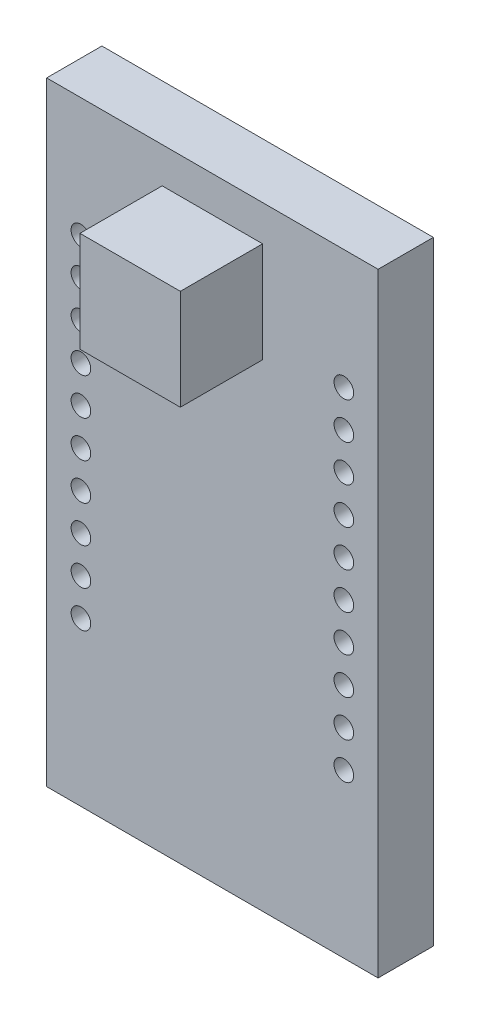
from build123d import *

# Parameters (mm, degrees)
SKETCH1_W           = 27
SKETCH1_H           = 50
BOSS_EXTRUDE1_DEPTH = 4.5
SKETCH2_W           = 8.18
SKETCH2_H           = 8.18
BOSS_EXTRUDE2_DEPTH = 6.7
SKETCH3_R           = 0.8
CUT_EXTRUDE1_DEPTH  = 6.7


with BuildPart() as part:
    # Sketch1 → Boss-Extrude1 (new body)
    with BuildSketch(Plane.XY):
        Rectangle(SKETCH1_W, SKETCH1_H)
    extrude(amount=BOSS_EXTRUDE1_DEPTH)

    # Sketch2 → Boss-Extrude2 (add)
    with BuildSketch(Plane.XY.offset(4.5)):
        with Locations((0, 18)):
            Rectangle(SKETCH2_W, SKETCH2_H)
    extrude(amount=BOSS_EXTRUDE2_DEPTH)

    # Sketch3 → Cut-Extrude1 (cut)
    with BuildSketch(Plane.XY.offset(4.5)):
        with Locations((10.7092899, 15.271061343)):
            Circle(SKETCH3_R)
        with Locations((10.7092899, 12.271061343)):
            Circle(SKETCH3_R)
        with Locations((10.7092899, 9.271061343)):
            Circle(SKETCH3_R)
        with Locations((10.7092899, 6.271061343)):
            Circle(SKETCH3_R)
        with Locations((10.7092899, 3.271061343)):
            Circle(SKETCH3_R)
        with Locations((10.7092899, 0.271061343)):
            Circle(SKETCH3_R)
        with Locations((10.7092899, -2.728938657)):
            Circle(SKETCH3_R)
        with Locations((10.7092899, -5.728938657)):
            Circle(SKETCH3_R)
        with Locations((10.7092899, -8.728938657)):
            Circle(SKETCH3_R)
        with Locations((10.7092899, -11.728938657)):
            Circle(SKETCH3_R)
    cut_extrude1 = extrude(amount=-CUT_EXTRUDE1_DEPTH, mode=Mode.SUBTRACT)

    # Mirror1: Cut-Extrude1 across plane
    add(cut_extrude1.mirror(Plane(origin=(0, 0, 0), x_dir=(0, 0, 1), z_dir=(1, 0, 0))), mode=Mode.SUBTRACT)


solid = part.part
